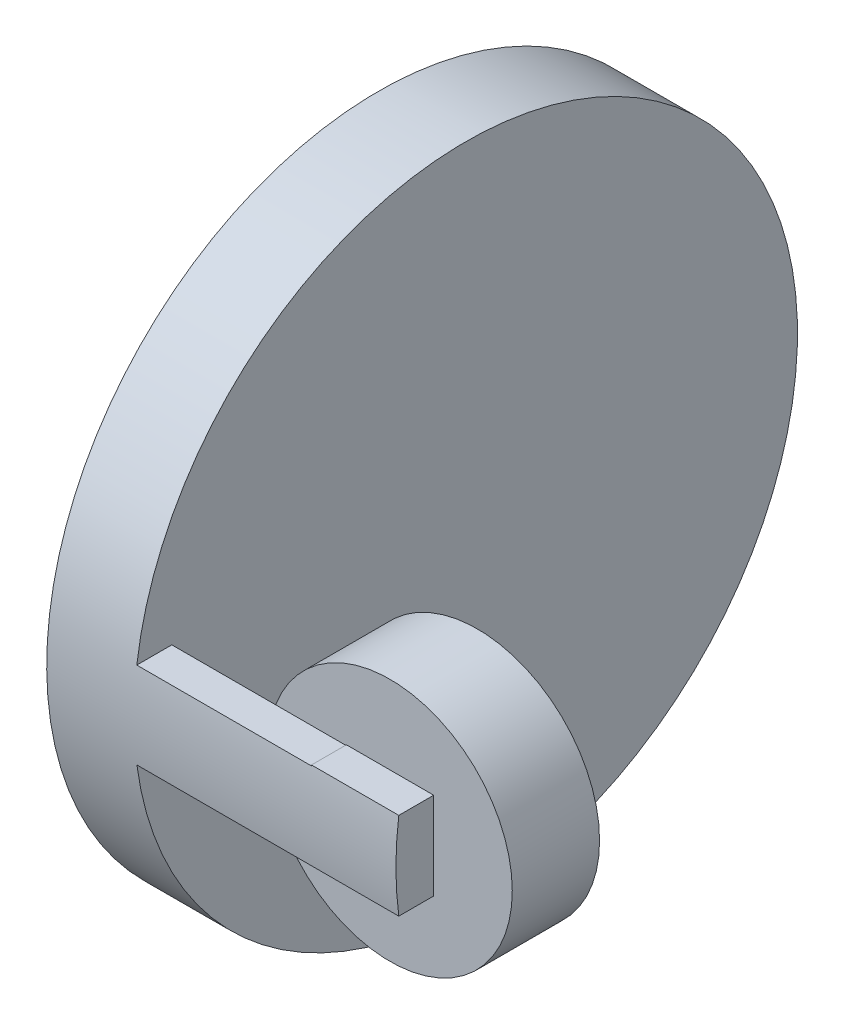
from build123d import *

# Parameters (mm, degrees)
SKETCH1_R           = 14
BOSS_EXTRUDE1_DEPTH = 10
SKETCH2_R           = 2.25
CUT_EXTRUDE1_DEPTH  = 5
SKETCH3_R           = 5
CUT_EXTRUDE2_DEPTH  = 1.8
SKETCH4_W           = 10
SKETCH4_H           = 10
BOSS_EXTRUDE2_DEPTH = 8
SKETCH6_W           = 8
SKETCH6_H           = 9.912865289
BOSS_EXTRUDE3_DEPTH = 20
CUT_EXTRUDE3_DEPTH  = 30
SKETCH8_R           = 38
BOSS_EXTRUDE4_DEPTH = 10
SKETCH9_R           = 29
BOSS_EXTRUDE5_DEPTH = 5


with BuildPart() as part:
    # Sketch1 → Boss-Extrude1 (new body)
    with BuildSketch(Plane.XY):
        Circle(SKETCH1_R)
    extrude(amount=BOSS_EXTRUDE1_DEPTH)

    # Sketch2 → Cut-Extrude1 (cut)
    with BuildSketch(Plane(origin=(0, 0, 0), x_dir=(-1, 0, 0), z_dir=(0, 0, -1))):
        Circle(SKETCH2_R)
    extrude(amount=-CUT_EXTRUDE1_DEPTH, mode=Mode.SUBTRACT)

    # Sketch3 → Cut-Extrude2 (cut)
    with BuildSketch(Plane(origin=(0, 0, 0), x_dir=(-1, 0, 0), z_dir=(0, 0, -1))):
        Circle(SKETCH3_R)
    extrude(amount=-CUT_EXTRUDE2_DEPTH, mode=Mode.SUBTRACT)

    # Sketch4 → Boss-Extrude2 (add)
    with BuildSketch(Plane.XY.offset(10)):
        Rectangle(SKETCH4_W, SKETCH4_H)
    extrude(amount=BOSS_EXTRUDE2_DEPTH)

    # Sketch6 → Boss-Extrude3 (add)
    with BuildSketch(Plane.ZY.offset(5)):
        with Locations((14, -0.043567356)):
            Rectangle(SKETCH6_W, SKETCH6_H)
    extrude(amount=BOSS_EXTRUDE3_DEPTH)

    # Sketch7 → Cut-Extrude3 (cut)
    with BuildSketch(Plane(origin=(5, 0, 0), x_dir=(0, 0, -1), z_dir=(1, 0, 0))):
        with BuildLine():
            Line((-18, 5), (-18, -5))
            Line((-18, -5), (-14, -5))
            ThreePointArc((-14, -5), (-14.330383596, 0), (-14, 5))
            Line((-14, 5), (-18, 5))
        make_face()
    extrude(amount=-CUT_EXTRUDE3_DEPTH, mode=Mode.SUBTRACT)

    # Sketch8 → Boss-Extrude4 (add)
    with BuildSketch(Plane.ZY.offset(25)):
        with Locations(Location((-23.669616404, 0, 0), (0, 0, 7.560843177))):
            Circle(SKETCH8_R)
    extrude(amount=BOSS_EXTRUDE4_DEPTH)

    # Sketch9 → Boss-Extrude5 (add)
    with BuildSketch(Plane.ZY.offset(35)):
        with Locations(Location((-23.669616404, 0.99287457, 0), (0, 0, 270))):
            Circle(SKETCH9_R)
    extrude(amount=BOSS_EXTRUDE5_DEPTH)


solid = part.part
